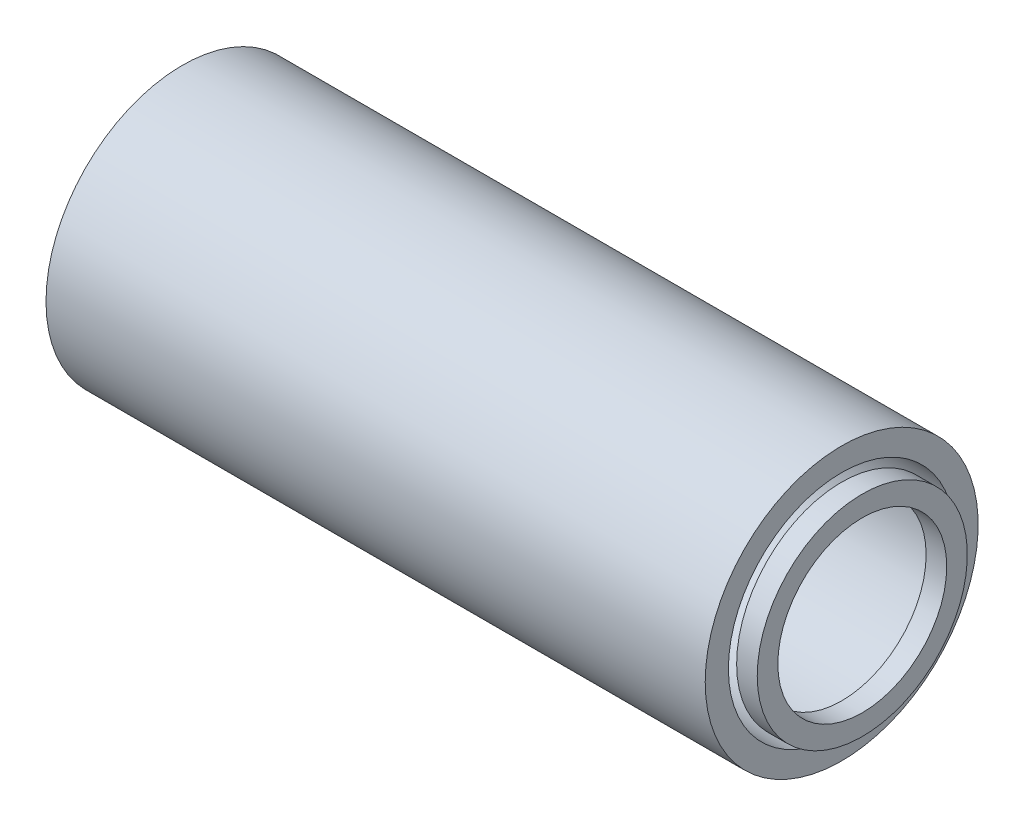
from build123d import *

# Parameters (mm, degrees)
SKETCH1_W = 101.6
SKETCH1_H = 3.571875
SKETCH2_W = 3.175
SKETCH2_H = 3.175


with BuildPart() as part:
    # Sketch1 → Revolve1 (revolve)
    with BuildSketch(Plane.XY, mode=Mode.PRIVATE) as revolve1_sk:
        with Locations((0, 19.2484375)):
            Rectangle(SKETCH1_W, SKETCH1_H)
    revolve(revolve1_sk.sketch.rotate(Axis((-50.8, 0, 0), (1, 0, 0)), 90), axis=Axis((-50.8, 0, 0), (1, 0, 0)))


with BuildPart() as body_2:
    # Sketch2 → Revolve2 (revolve)
    with BuildSketch(Plane.XY, mode=Mode.PRIVATE) as revolve2_sk:
        with Locations((52.3875, 14.605)):
            Rectangle(SKETCH2_W, SKETCH2_H)
    revolve(revolve2_sk.sketch.rotate(Axis((50.8, 0, 0), (1, 0, 0)), 90), axis=Axis((50.8, 0, 0), (1, 0, 0)))


with BuildPart() as body_3:
    # Mirror2: mirrored copy
    add(body_2.part.mirror(Plane(origin=(0, 0, 0), x_dir=(0, 0, 1), z_dir=(1, 0, 0))))


solid = Compound([part.part, body_2.part, body_3.part])
